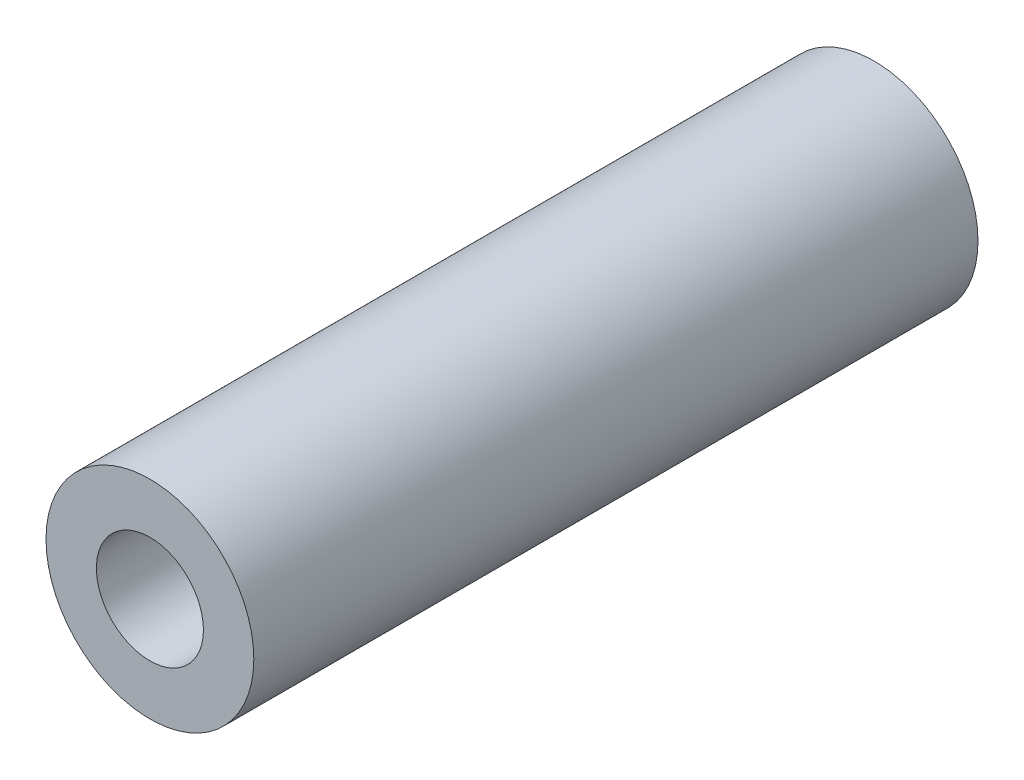
from build123d import *

# Parameters (mm, degrees)
SKETCH1_R           = 3.3
SKETCH1_R_2         = 1.7
BOSS_EXTRUDE1_DEPTH = 23


with BuildPart() as part:
    # Sketch1 → Boss-Extrude1 (new body)
    with BuildSketch(Plane.XY):
        Circle(SKETCH1_R)
        Circle(SKETCH1_R_2, mode=Mode.SUBTRACT)
    extrude(amount=BOSS_EXTRUDE1_DEPTH)


solid = part.part
